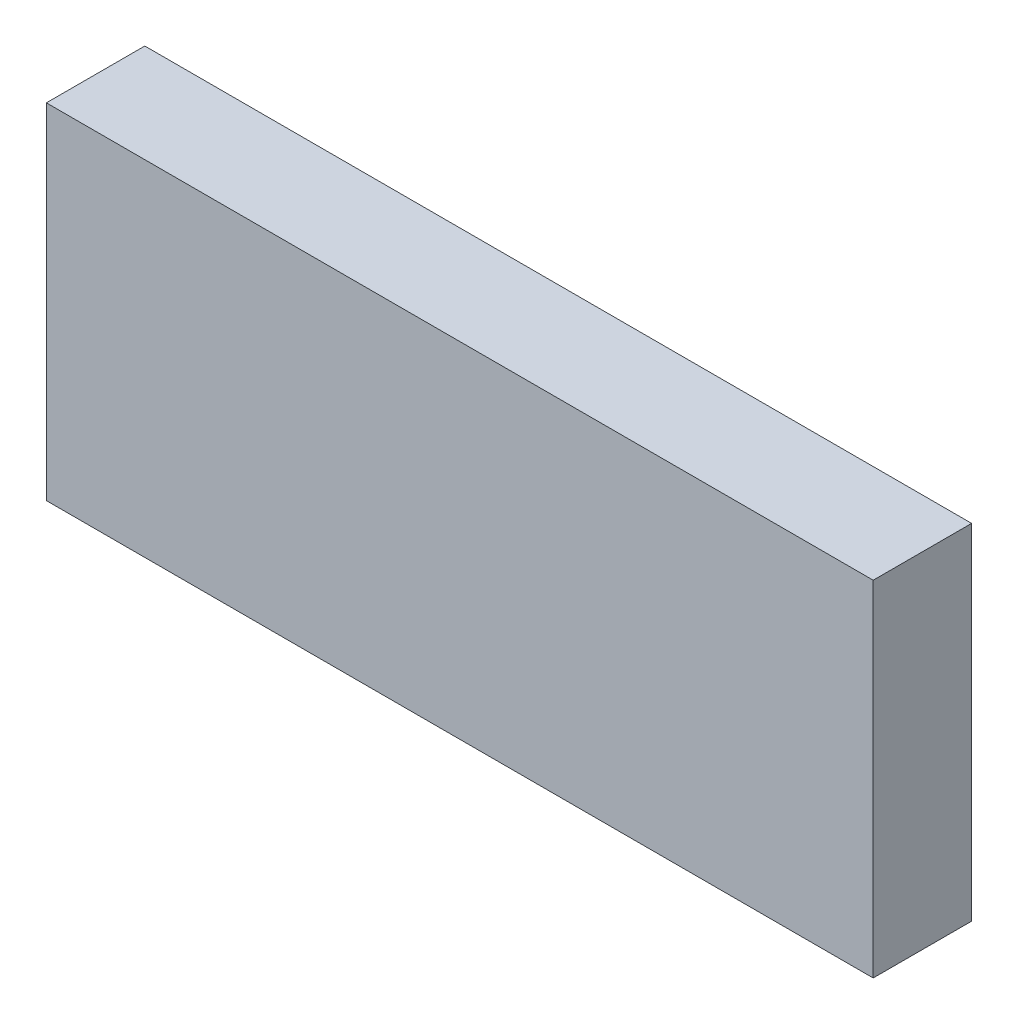
from build123d import *

# Parameters (mm, degrees)
SKETCH1_W           = 106.68
SKETCH1_H           = 44.45
BOSS_EXTRUDE1_DEPTH = 12.7


with BuildPart() as part:
    # Sketch1 → Boss-Extrude1 (new body)
    with BuildSketch(Plane.XY):
        Rectangle(SKETCH1_W, SKETCH1_H)
    extrude(amount=BOSS_EXTRUDE1_DEPTH)


solid = part.part
